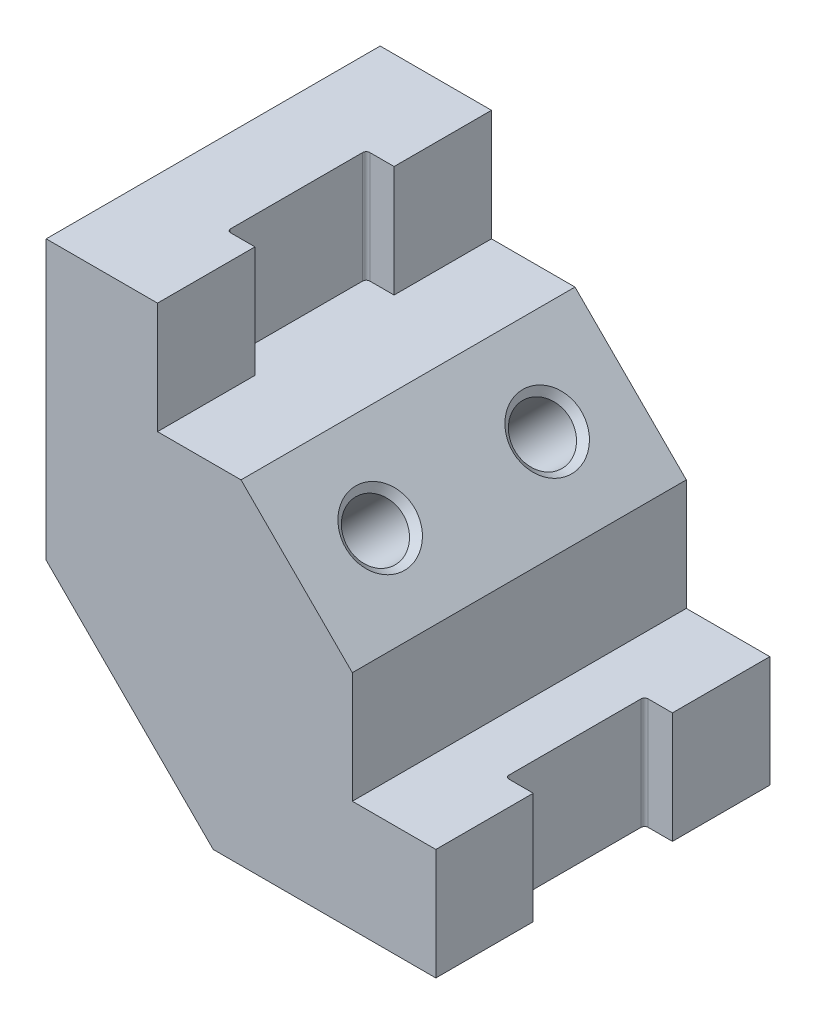
from build123d import *

# Parameters (mm, degrees)
BOSS_EXTRUDE1_DEPTH = 76.2
SKETCH6_W           = 6.35
SKETCH6_H           = 31.75
CUT_EXTRUDE2_DEPTH  = 25.4
FILLET2_R           = 0.8128
SKETCH7_R           = 6.35
CUT_EXTRUDE3_DEPTH  = 76.2
CHAMFER1_SIZE       = 1.524
SKETCH8_W           = 6.35
SKETCH8_H           = 31.75
CUT_EXTRUDE4_DEPTH  = 125.609544076
FILLET3_R           = 0.8128


with BuildPart() as part:
    # Sketch2 → Boss-Extrude1 (new body)
    with BuildSketch(Plane.XY):
        Polygon((-62.567231638, 49.006214689), (-62.567231638, -14.493785311), (-24.467231638, -52.593785311), (26.332768362, -52.593785311), (26.332768362, -27.193785311), (7.282768362, -27.193785311), (7.282768362, -1.793785311), (-18.117231638, 23.606214689), (-37.167231638, 23.606214689), (-37.167231638, 49.006214689), align=None)
    extrude(amount=-BOSS_EXTRUDE1_DEPTH)

    # Sketch6 → Cut-Extrude2 (cut)
    with BuildSketch(Plane(origin=(0, 49.006214689, 0), x_dir=(1, 0, 0), z_dir=(0, 1, 0))):
        with Locations((-40.342231638, 38.1)):
            Rectangle(SKETCH6_W, SKETCH6_H)
    extrude(amount=-CUT_EXTRUDE2_DEPTH, mode=Mode.SUBTRACT)

    # Fillet2
    fillet2_edges = [part.edges().sort_by_distance(p)[0] for p in [
        (-43.517231638, 36.306214689, -22.225),
        (-43.517231638, 36.306214689, -53.975),
    ]]
    fillet(fillet2_edges, radius=FILLET2_R)

    # Sketch7 → Cut-Extrude3 (cut)
    with BuildSketch(Plane(origin=(2.744491525, 2.744491525, 0), x_dir=(0, 0, -1), z_dir=(0.7071067811865436, 0.7071067811865515, 0))):
        with Locations(Location((57.15, 11.539707349, 0), (0, 0, 90))):
            Circle(SKETCH7_R)
        with Locations(Location((19.05, 11.539707349, 0), (0, 0, 90))):
            Circle(SKETCH7_R)
    extrude(amount=-CUT_EXTRUDE3_DEPTH, mode=Mode.SUBTRACT)

    # Chamfer1
    chamfer1_edges = [part.edges().sort_by_distance(p)[0] for p in [
        (-0.925185733, 6.414168784, -19.05),
        (-0.925185733, 6.414168784, -57.15),
    ]]
    chamfer(chamfer1_edges, length=CHAMFER1_SIZE)

    # Sketch8 → Cut-Extrude4 (cut, through all)
    with BuildSketch(Plane(origin=(0, -27.193785311, 0), x_dir=(1, 0, 0), z_dir=(0, 1, 0))):
        with Locations((23.157768362, 38.1)):
            Rectangle(SKETCH8_W, SKETCH8_H)
    extrude(amount=-CUT_EXTRUDE4_DEPTH, mode=Mode.SUBTRACT)

    # Fillet3
    fillet3_edges = [part.edges().sort_by_distance(p)[0] for p in [
        (19.982768362, -39.893785311, -22.225),
        (19.982768362, -39.893785311, -53.975),
    ]]
    fillet(fillet3_edges, radius=FILLET3_R)


solid = part.part
